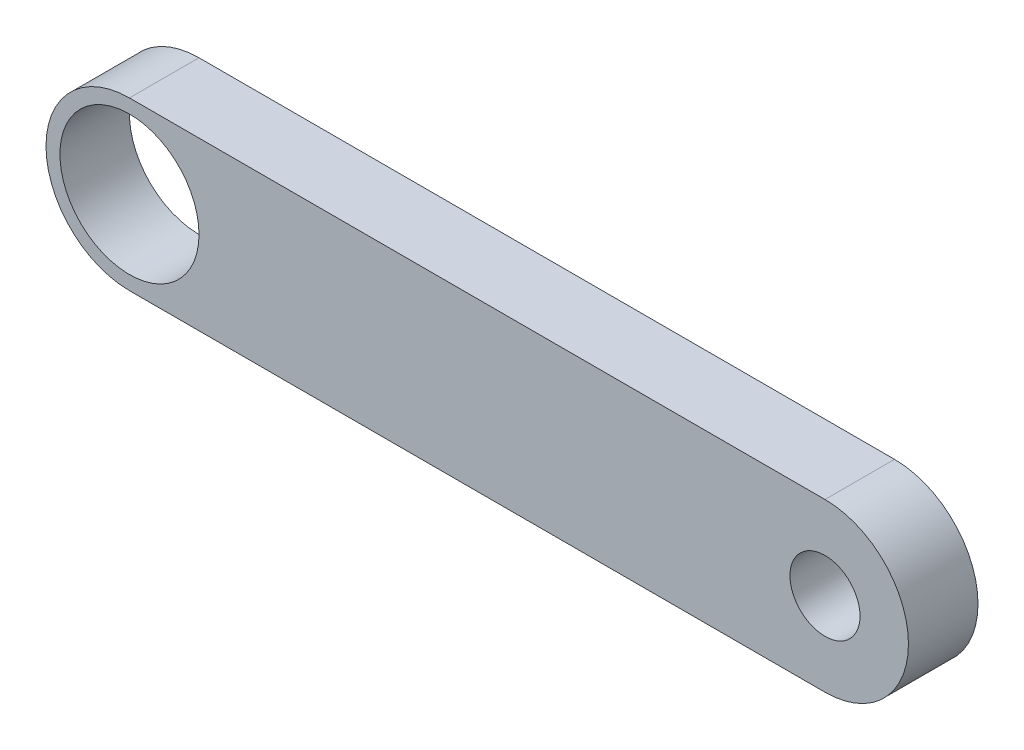
from build123d import *

# Parameters (mm, degrees)
SKETCH_1_R          = 2.518951354
EXTRUDE_1_DEPTH     = 5
SKETCH_2_R          = 5
CUT_EXTRUDE_1_DEPTH = 5


with BuildPart() as part:
    # 草图1 → 凸台-拉伸1 (new body)
    with BuildSketch(Plane.XY):
        with BuildLine():
            Line((0, 6), (50, 6))
            ThreePointArc((50, 6), (56, 0), (50, -6))
            Line((50, -6), (0, -6))
            ThreePointArc((0, -6), (-6, 0), (0, 6))
        make_face()
        with Locations((50, 0)):
            Circle(SKETCH_1_R, mode=Mode.SUBTRACT)
    extrude(amount=EXTRUDE_1_DEPTH)

    # 草图2 → 切除-拉伸1 (cut)
    with BuildSketch(Plane.XY.offset(5)):
        Circle(SKETCH_2_R)
    extrude(amount=-CUT_EXTRUDE_1_DEPTH, mode=Mode.SUBTRACT)


solid = part.part
